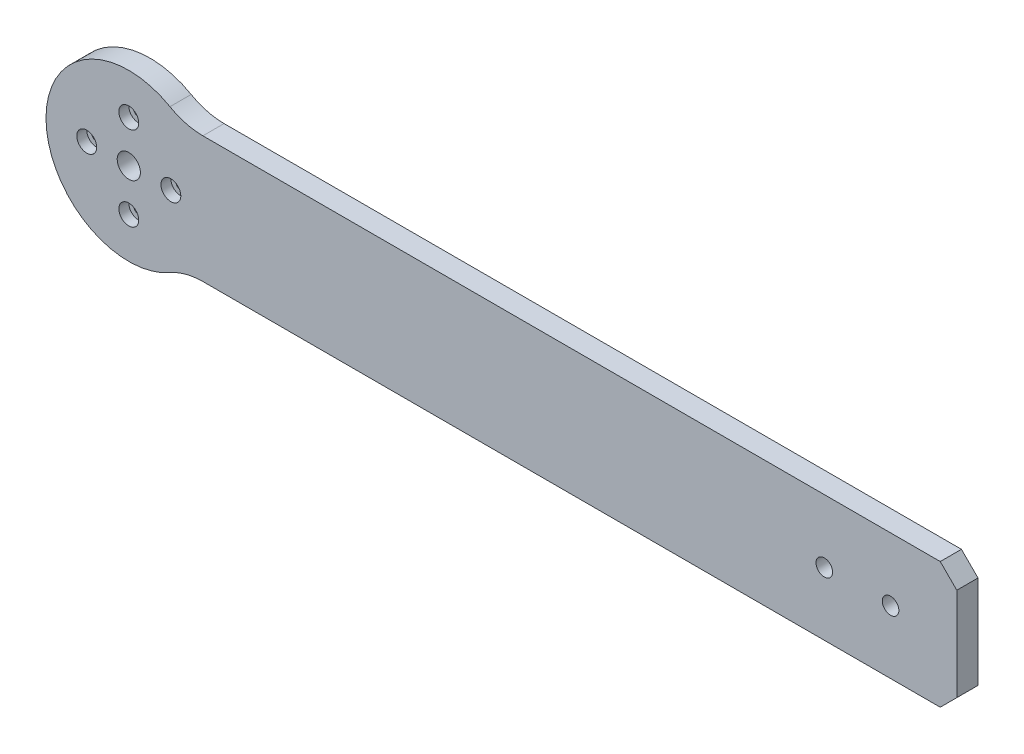
from build123d import *

# Parameters (mm, degrees)
SKETCH1_R           = 2.5
SKETCH1_R_2         = 1.5
SKETCH1_R_3         = 3.5
BOSS_EXTRUDE1_DEPTH = 6.4
SKETCH2_R           = 3
CUT_EXTRUDE1_DEPTH  = 3
FILLET1_R           = 20
CHAMFER1_SIZE       = 5


with BuildPart() as part:
    # Sketch1 → Boss-Extrude1 (new body)
    with BuildSketch(Plane.XY):
        with BuildLine():
            Line((250, 19.05), (16.189425561, 19.05))
            ThreePointArc((16.189425561, 19.05), (-25, 0), (16.189425561, -19.05))
            Line((16.189425561, -19.05), (250, -19.05))
            Line((250, -19.05), (250, 19.05))
        make_face()
        with Locations((230, 0)):
            Circle(SKETCH1_R, mode=Mode.SUBTRACT)
        with Locations((210, 0)):
            Circle(SKETCH1_R, mode=Mode.SUBTRACT)
        with Locations((0, 12.7)):
            Circle(SKETCH1_R_2, mode=Mode.SUBTRACT)
        with Locations((12.7, 0)):
            Circle(SKETCH1_R_2, mode=Mode.SUBTRACT)
        with Locations((0, -12.7)):
            Circle(SKETCH1_R_2, mode=Mode.SUBTRACT)
        with Locations((-12.7, 0)):
            Circle(SKETCH1_R_2, mode=Mode.SUBTRACT)
        Circle(SKETCH1_R_3, mode=Mode.SUBTRACT)
    extrude(amount=BOSS_EXTRUDE1_DEPTH)

    # Sketch2 → Cut-Extrude1 (cut)
    with BuildSketch(Plane.XY.offset(6.4)):
        with Locations((0, 12.7)):
            Circle(SKETCH2_R)
        with Locations((12.7, 0)):
            Circle(SKETCH2_R)
        with Locations((0, -12.7)):
            Circle(SKETCH2_R)
        with Locations((-12.7, 0)):
            Circle(SKETCH2_R)
    extrude(amount=-CUT_EXTRUDE1_DEPTH, mode=Mode.SUBTRACT)

    # Fillet1
    fillet1_edges = [part.edges().sort_by_distance(p)[0] for p in [
        (16.189425561, -19.05, 3.2),
        (16.189425561, 19.05, 3.2),
    ]]
    fillet(fillet1_edges, radius=FILLET1_R)

    # Chamfer1
    chamfer1_edges = [part.edges().sort_by_distance(p)[0] for p in [
        (250, -19.05, 3.2),
        (250, 19.05, 3.2),
    ]]
    chamfer(chamfer1_edges, length=CHAMFER1_SIZE)


solid = part.part
